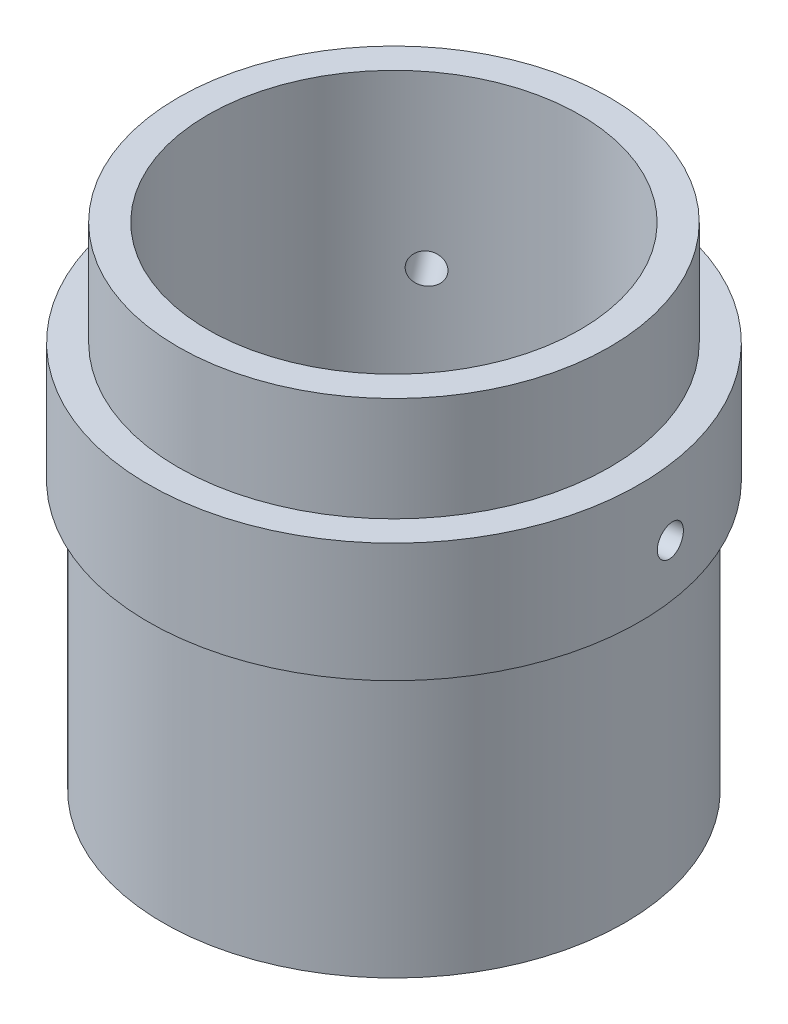
from build123d import *

# Parameters (mm, degrees)
MATRIZC1_COUNT = 3


with BuildPart() as part:
    # Croquis1 → Revolución1 (revolve)
    with BuildSketch(Plane.XY, mode=Mode.PRIVATE) as revoluci_n1_sk:
        Polygon((6.371214478, 0), (6.371214478, 18), (7.371214478, 18), (7.371214478, 26), (5.371214478, 26), (5.371214478, 33), (3.371214478, 33), (3.371214478, 0), align=None)
    revolve(revoluci_n1_sk.sketch.rotate(Axis((-9.128785522, 76.373603091, 0), (0, -1, 0)), 180), axis=Axis((-9.128785522, 76.373603091, 0), (0, -1, 0)))

    # Croquis2 → Perforador para roscar para macho de roscar para M2.5x0.451 (revolve, cut)
    with BuildSketch(Plane(origin=(7.216426647, 21.537901264, -2.254781399), x_dir=(-0.13665341811634468, 0, -0.9906189193212089), z_dir=(0, 1, 0))):
        Polygon((0, 0), (0, 10.615882135), (1.025, 10), (1.025, 0), align=None)
    perforador_para_roscar_para_macho_de_ros = revolve(axis=Axis((13.506856785, 21.537901264, -3.122530604), (-0.9906189193212088, 0, 0.13665341811634468)), mode=Mode.SUBTRACT)

    # MatrizC1: Perforador para roscar para macho de roscar para M2.5x0.451 ×3 about axis, 1 skipped
    matrizc1_axis = Axis((-9.128785522, 26, 0), (0, 1, 0))
    add([perforador_para_roscar_para_macho_de_ros.rotate(matrizc1_axis, i * 360 / MATRIZC1_COUNT) for i in range(1, MATRIZC1_COUNT) if i not in (2,)], mode=Mode.SUBTRACT)


solid = part.part
